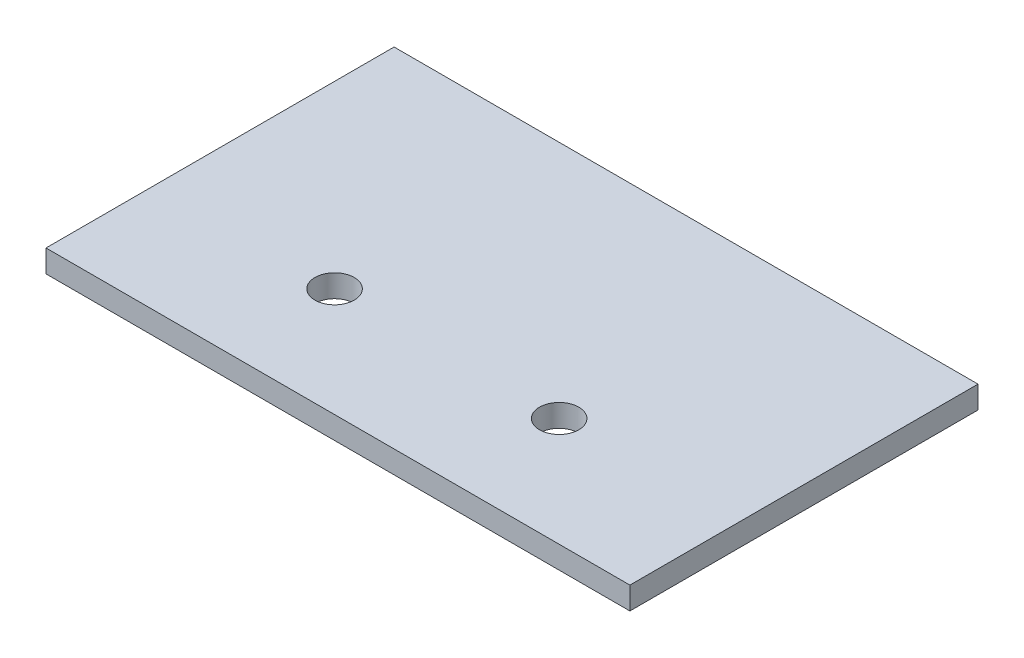
from build123d import *

# Parameters (mm, degrees)
SKETCH1_W           = 52
SKETCH1_H           = 31
SKETCH1_R           = 1.75
BOSS_EXTRUDE1_DEPTH = 2


with BuildPart() as part:
    # Sketch1 → Boss-Extrude1 (new body)
    with BuildSketch(Plane(origin=(0, 0, 0), x_dir=(1, 0, 0), z_dir=(0, 1, 0))):
        Rectangle(SKETCH1_W, SKETCH1_H)
        with Locations(Location((-10, -5.8, 0), (0, 0, 270))):
            Circle(SKETCH1_R, mode=Mode.SUBTRACT)
        with Locations(Location((10, -5.8, 0), (0, 0, 270))):
            Circle(SKETCH1_R, mode=Mode.SUBTRACT)
    extrude(amount=BOSS_EXTRUDE1_DEPTH)


solid = part.part
